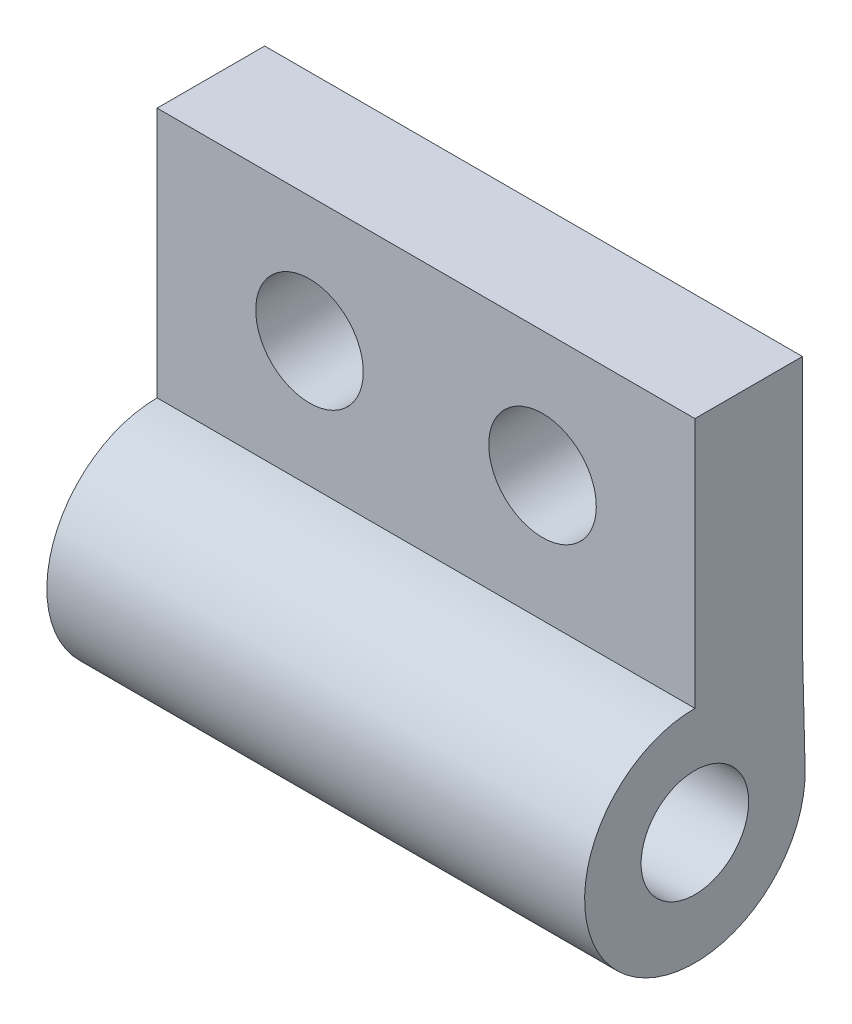
from build123d import *

# Parameters (mm, degrees)
SZKIC1_W                    = 15
SZKIC1_H                    = 7
SZKIC1_R                    = 1.5
DODANIE_WYCI_GNI_CIE2_DEPTH = 3
SZKIC2_R                    = 1.5
DODANIE_WYCI_GNI_CIE3_DEPTH = 15


with BuildPart() as part:
    # Szkic1 → Dodanie-wyciągnięcie2 (new body)
    with BuildSketch(Plane.XY):
        Rectangle(SZKIC1_W, SZKIC1_H)
        with Locations((-3.25, 0)):
            Circle(SZKIC1_R, mode=Mode.SUBTRACT)
        with Locations((3.25, 0)):
            Circle(SZKIC1_R, mode=Mode.SUBTRACT)
    extrude(amount=DODANIE_WYCI_GNI_CIE2_DEPTH)

    # Szkic2 → Dodanie-wyciągnięcie3 (add)
    with BuildSketch(Plane(origin=(7.5, 0, 0), x_dir=(0, 0, -1), z_dir=(1, 0, 0))):
        with BuildLine():
            Line((0, -3.5), (0.074433096, -6.499076619))
            ThreePointArc((0.074433096, -6.499076619), (-5.147475229, -8.776813713), (-3, -3.5))
            Line((-3, -3.5), (0, -3.5))
        make_face()
        with Locations((-3, -6.5)):
            Circle(SZKIC2_R, mode=Mode.SUBTRACT)
    extrude(amount=-DODANIE_WYCI_GNI_CIE3_DEPTH)


solid = part.part
